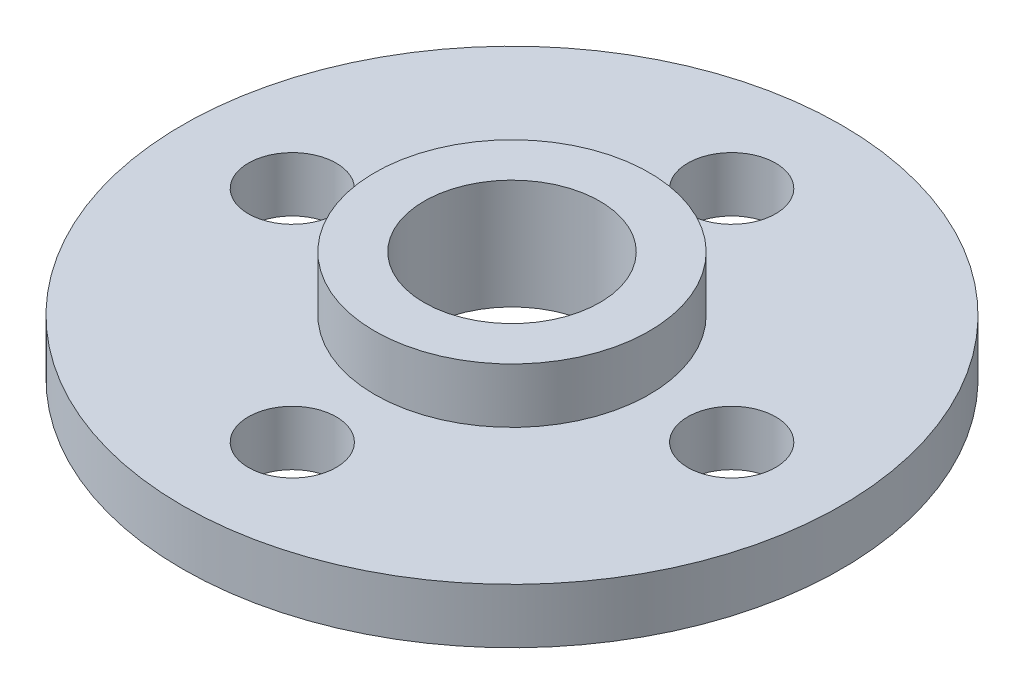
from build123d import *

# Parameters (mm, degrees)
SKETCH1_R           = 30
SKETCH1_R_2         = 4
SKETCH1_R_3         = 12.5
BOSS_EXTRUDE1_DEPTH = 5
SKETCH1_6_R         = 12.5
SKETCH1_6_R_2       = 8
BOSS_EXTRUDE2_DEPTH = 10


with BuildPart() as part:
    # Sketch1 → Boss-Extrude1 (new body)
    with BuildSketch(Plane(origin=(0, 0, 0), x_dir=(1, 0, 0), z_dir=(0, 1, 0))):
        Circle(SKETCH1_R)
        with Locations((0, 20)):
            Circle(SKETCH1_R_2, mode=Mode.SUBTRACT)
        with Locations((20, 0)):
            Circle(SKETCH1_R_2, mode=Mode.SUBTRACT)
        with Locations((0, -20)):
            Circle(SKETCH1_R_2, mode=Mode.SUBTRACT)
        with Locations((-20, 0)):
            Circle(SKETCH1_R_2, mode=Mode.SUBTRACT)
        Circle(SKETCH1_R_3, mode=Mode.SUBTRACT)
    extrude(amount=BOSS_EXTRUDE1_DEPTH)

    # Sketch1<6> → Boss-Extrude2 (add)
    with BuildSketch(Plane(origin=(0, 0, 0), x_dir=(1, 0, 0), z_dir=(0, 1, 0))):
        Circle(SKETCH1_6_R)
        Circle(SKETCH1_6_R_2, mode=Mode.SUBTRACT)
    extrude(amount=BOSS_EXTRUDE2_DEPTH)


solid = part.part
